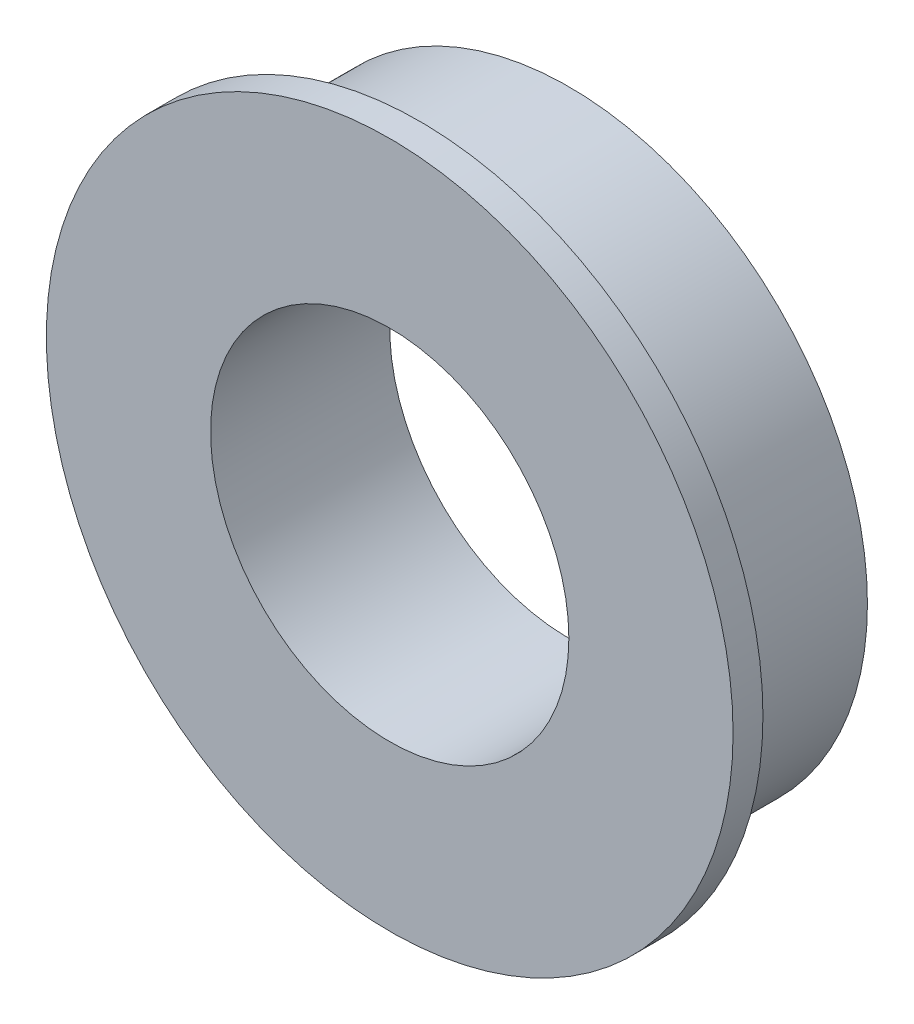
from build123d import *


with BuildPart() as part:
    # ｽｹｯﾁ1 → 回転1 (revolve)
    with BuildSketch(Plane(origin=(0, 0, 0), x_dir=(0, 0, -1), z_dir=(1, 0, 0)), mode=Mode.PRIVATE) as revolve_1_sk:
        Polygon((-0.5, 5.75), (-0.5, 3), (2.5, 3), (2.5, 5), (0, 5), (0, 5.75), align=None)
    revolve(revolve_1_sk.sketch.rotate(Axis((0, 0, 0), (0, 0, -1)), 90), axis=Axis((0, 0, 0), (0, 0, -1)))


solid = part.part
